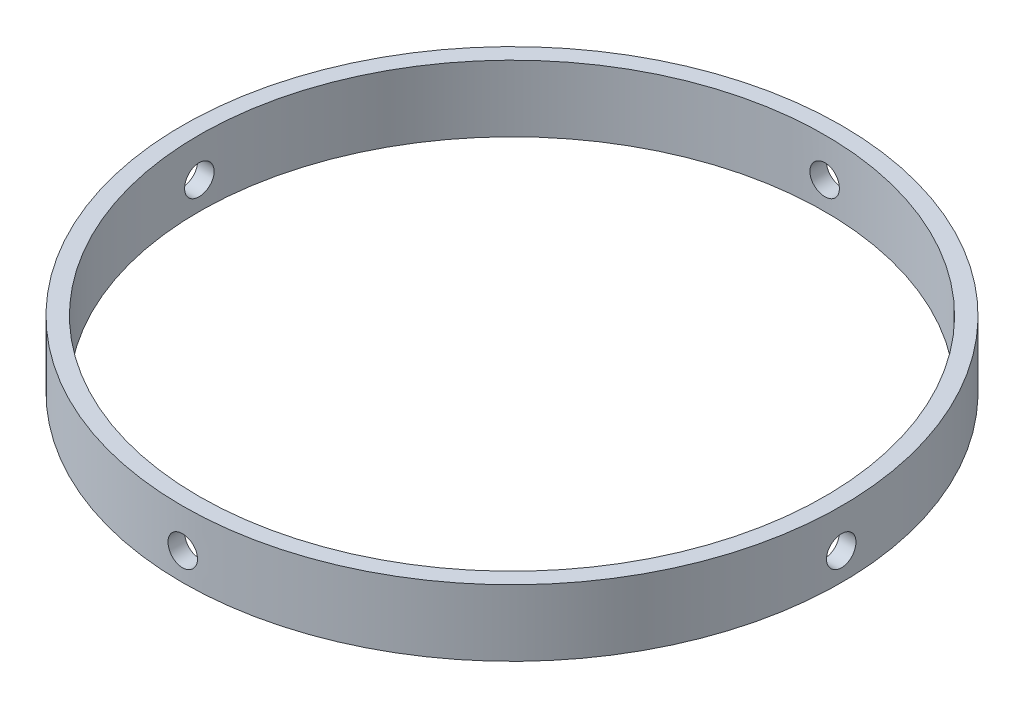
from build123d import *

# Parameters (mm, degrees)
SKETCH1_R           = 37.846
SKETCH1_R_2         = 35.941
BOSS_EXTRUDE1_DEPTH = 7.62
SKETCH2_R           = 1.692869147
CUT_EXTRUDE1_DEPTH  = 86.62
CIRPATTERN1_COUNT   = 4


with BuildPart() as part:
    # Sketch1 → Boss-Extrude1 (new body)
    with BuildSketch(Plane(origin=(0, 0, 0), x_dir=(1, 0, 0), z_dir=(0, 1, 0))):
        with Locations(Location((0, 0, 0), (0, 0, 90))):
            Circle(SKETCH1_R)
        with Locations(Location((0, 0, 0), (0, 0, 90))):
            Circle(SKETCH1_R_2, mode=Mode.SUBTRACT)
    extrude(amount=BOSS_EXTRUDE1_DEPTH)

    # Sketch2 → Cut-Extrude1 (cut)
    with BuildSketch(Plane.XY):
        with Locations(Location((0, 3.171011831, 0), (0, 0, 180))):
            Circle(SKETCH2_R)
    cut_extrude1 = extrude(amount=CUT_EXTRUDE1_DEPTH, mode=Mode.SUBTRACT)

    # CirPattern1: Cut-Extrude1 ×4 about axis
    cirpattern1_axis = Axis((0, 7.62, 0), (0, -1, 0))
    for i in range(1, CIRPATTERN1_COUNT):
        add(cut_extrude1.rotate(cirpattern1_axis, i * 360 / CIRPATTERN1_COUNT), mode=Mode.SUBTRACT)


solid = part.part
